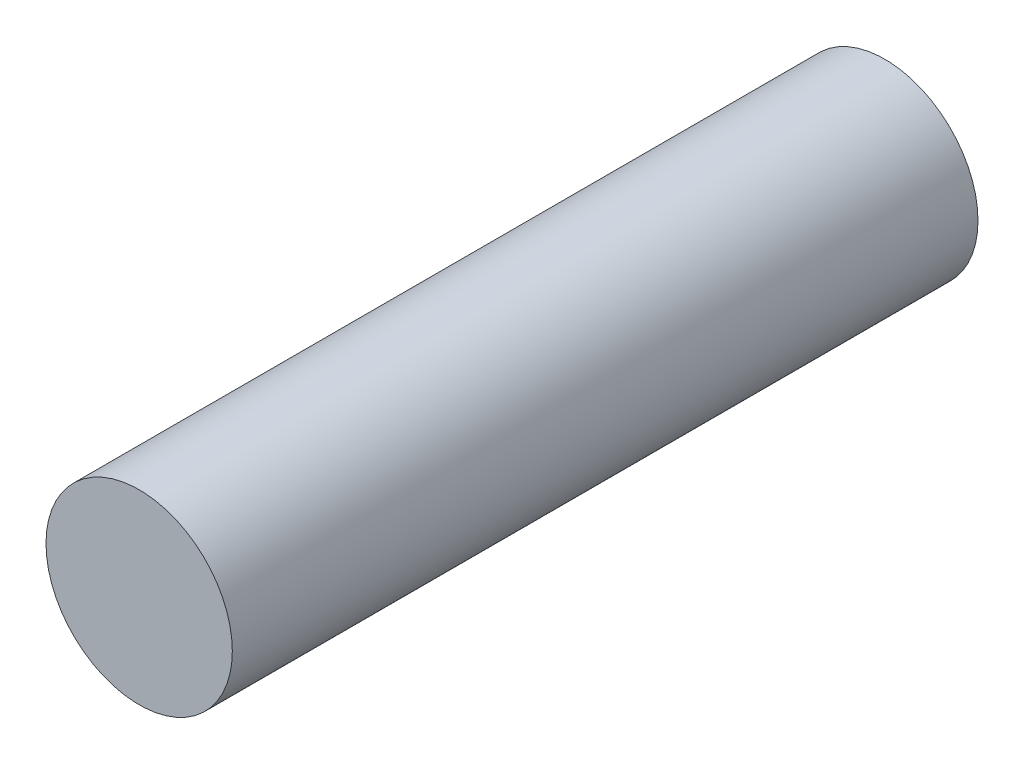
from build123d import *

# Parameters (mm, degrees)
IZIM1_R                     = 4.76
Y_KSEKLIK_EKSTR_ZYON1_DEPTH = 38.1


with BuildPart() as part:
    # Çizim1 → Yükseklik-Ekstrüzyon1 (new body)
    with BuildSketch(Plane.XY):
        with Locations(Location((0, 0, 0), (0, 0, 180))):
            Circle(IZIM1_R)
    extrude(amount=Y_KSEKLIK_EKSTR_ZYON1_DEPTH)


solid = part.part
